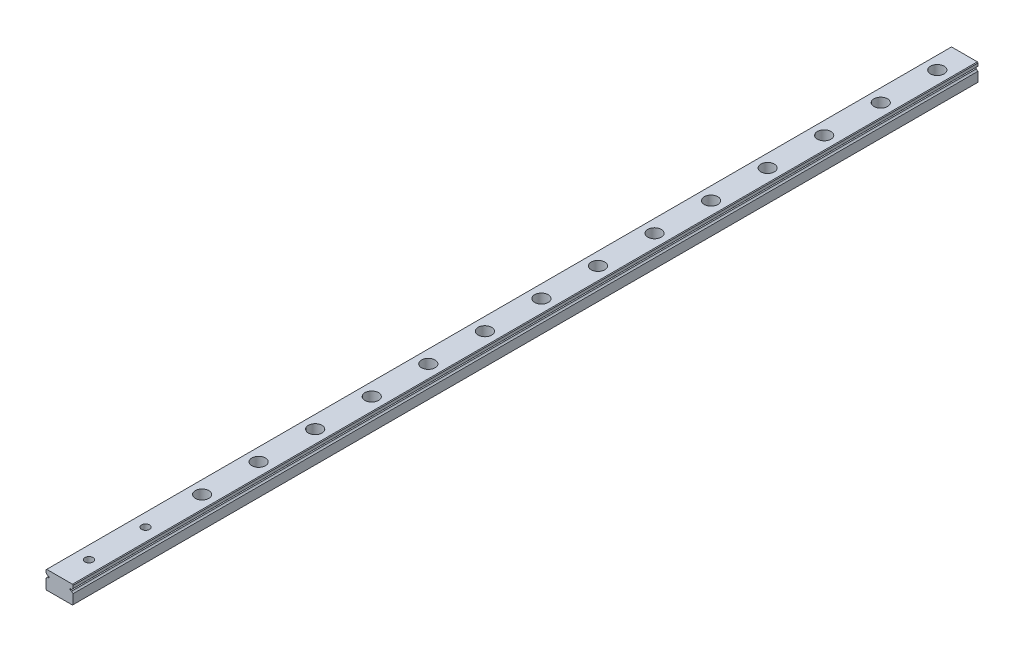
from build123d import *

# Parameters (mm, degrees)
EXTRUDE_1_DEPTH        = 400
SKETCH_2_R             = 3
SKETCH_2_R_2           = 1.75
CUT_EXTRUDE_1_DEPTH    = 4.5
SKETCH_2_2_R           = 1.75
CUT_EXTRUDE_2_DEPTH    = 401.124980475
PATTERN_LINEAR_1_COUNT = 14
PATTERN_LINEAR_1_PITCH = 25
CROQUIS1_R             = 1.75
CORTAR_EXTRUIR1_DEPTH  = 8


with BuildPart() as part:
    # Эскиз1 → Бобышка-Вытянуть1 (new body)
    with BuildSketch(Plane.XY):
        with BuildLine():
            Line((-6, 3.7), (-5.7, 4))
            Line((-5.7, 4), (5.7, 4))
            Line((5.7, 4), (6, 3.7))
            Line((6, 3.7), (6, 2.451013544))
            ThreePointArc((6, 2.451013544), (5.597935912, 2.202976267), (5.354599002, 1.798050138))
            Line((5.354599002, 1.798050138), (4.643514056, 1.798050138))
            Line((4.643514056, 1.798050138), (4.643514056, 1.201949862))
            Line((4.643514056, 1.201949862), (5.354599002, 1.201949862))
            ThreePointArc((5.354599002, 1.201949862), (5.597935912, 0.797023733), (6, 0.548986456))
            Line((6, 0.548986456), (6, -3.7))
            Line((6, -3.7), (5.7, -4))
            Line((5.7, -4), (-5.7, -4))
            Line((-5.7, -4), (-6, -3.7))
            Line((-6, -3.7), (-6, 0.548986456))
            ThreePointArc((-6, 0.548986456), (-5.597935912, 0.797023733), (-5.354599002, 1.201949862))
            Line((-5.354599002, 1.201949862), (-4.643514056, 1.201949862))
            Line((-4.643514056, 1.201949862), (-4.643514056, 1.798050138))
            Line((-4.643514056, 1.798050138), (-5.354599002, 1.798050138))
            ThreePointArc((-5.354599002, 1.798050138), (-5.597935912, 2.202976267), (-6, 2.451013544))
            Line((-6, 2.451013544), (-6, 3.7))
        make_face()
    extrude(amount=EXTRUDE_1_DEPTH)

    # Эскиз2 → Вырез-Вытянуть1 (cut)
    with BuildSketch(Plane(origin=(0, 4, 0), x_dir=(1, 0, 0), z_dir=(0, 1, 0))):
        with Locations(Location((0, -12, 0), (0, 0, 270))):
            Circle(SKETCH_2_R)
        with Locations(Location((0, -12, 0), (0, 0, 270))):
            Circle(SKETCH_2_R_2, mode=Mode.SUBTRACT)
    cut_extrude_1 = extrude(amount=-CUT_EXTRUDE_1_DEPTH, mode=Mode.SUBTRACT)

    # Эскиз2<2> → Вырез-Вытянуть2 (cut, through all)
    with BuildSketch(Plane(origin=(0, 4, 0), x_dir=(1, 0, 0), z_dir=(0, 1, 0))):
        with Locations(Location((0, -12, 0), (0, 0, 270))):
            Circle(SKETCH_2_2_R)
    cut_extrude_2 = extrude(amount=-CUT_EXTRUDE_2_DEPTH, mode=Mode.SUBTRACT)

    # Линейный массив1: Вырез-Вытянуть1, Вырез-Вытянуть2 ×14
    with Locations(*[(0, 0, i * PATTERN_LINEAR_1_PITCH) for i in range(1, PATTERN_LINEAR_1_COUNT)]):
        add(cut_extrude_1, mode=Mode.SUBTRACT)
        add(cut_extrude_2, mode=Mode.SUBTRACT)

    # Croquis1 → Cortar-Extruir1 (cut)
    with BuildSketch(Plane(origin=(0, 4, 0), x_dir=(1, 0, 0), z_dir=(0, 1, 0))):
        with Locations(Location((0, -387, 0), (0, 0, 270))):
            Circle(CROQUIS1_R)
        with Locations(Location((0, -362, 0), (0, 0, 270))):
            Circle(CROQUIS1_R)
    extrude(amount=-CORTAR_EXTRUIR1_DEPTH, mode=Mode.SUBTRACT)


solid = part.part
